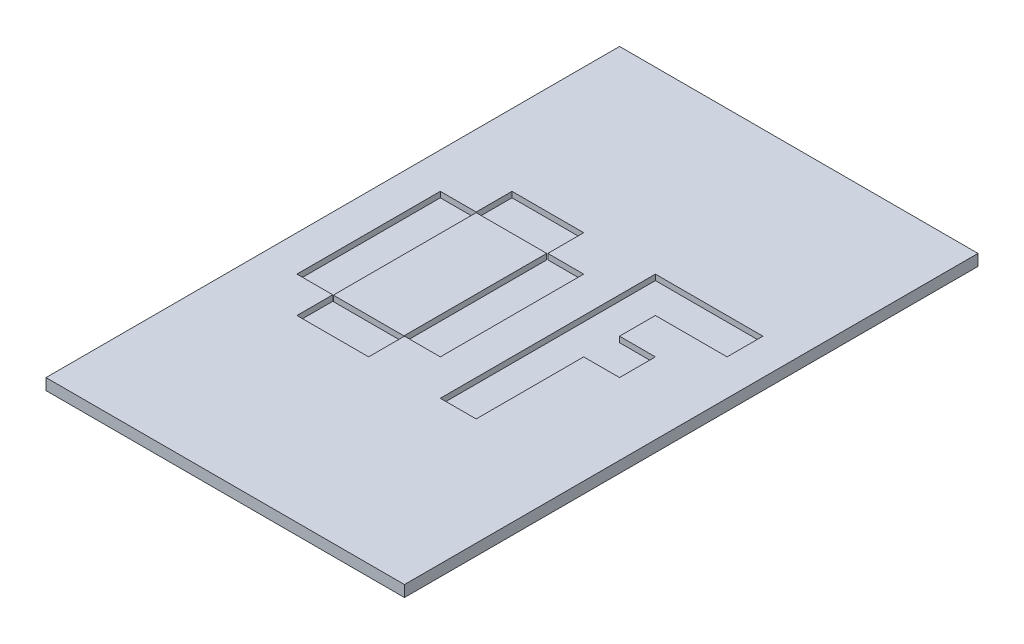
from build123d import *

# Parameters (mm, degrees)
SKETCH1_W            = 127
SKETCH1_H            = 203.2
BOSS_EXTRUDE1_DEPTH  = 4
CUT_EXTRUDE4_DEPTH   = 2
CUT_EXTRUDE8_DEPTH   = 2
SKETCH4_W            = 25
SKETCH4_H            = 50.6
BOSS_EXTRUDE10_DEPTH = 2


with BuildPart() as part:
    # Sketch1 → Boss-Extrude1 (new body)
    with BuildSketch(Plane(origin=(0, 0, 0), x_dir=(1, 0, 0), z_dir=(0, 1, 0))):
        with Locations((63.5, 101.6)):
            Rectangle(SKETCH1_W, SKETCH1_H)
    extrude(amount=BOSS_EXTRUDE1_DEPTH)

    # Sketch2 → Cut-Extrude4 (cut)
    with BuildSketch(Plane(origin=(0, 4, 0), x_dir=(1, 0, 0), z_dir=(0, 1, 0))):
        Polygon((88.9, 127), (88.9, 114.3), (101.6, 114.3), (101.6, 101.6), (88.9, 101.6), (88.9, 63.5), (76.2, 63.5), (76.2, 139.7), (88.9, 139.7), (114.3, 139.7), (114.3, 127), align=None)
    extrude(amount=-CUT_EXTRUDE4_DEPTH, mode=Mode.SUBTRACT)

    # Sketch2<5> → Cut-Extrude8 (cut)
    with BuildSketch(Plane(origin=(0, 4, 0), x_dir=(1, 0, 0), z_dir=(0, 1, 0))):
        Polygon((25.4, 127), (12.7, 127), (12.7, 76.2), (25.4, 76.2), (25.4, 63.5), (50.8, 63.5), (50.8, 76.2), (63.5, 76.2), (63.5, 127), (50.8, 127), (50.8, 139.7), (25.4, 139.7), align=None)
    extrude(amount=-CUT_EXTRUDE8_DEPTH, mode=Mode.SUBTRACT)


with BuildPart() as body_2:
    # Sketch4 → Boss-Extrude10 (new body)
    with BuildSketch(Plane(origin=(0, 2, 0), x_dir=(1, 0, 0), z_dir=(0, 1, 0))):
        with Locations((38.1, 101.5)):
            Rectangle(SKETCH4_W, SKETCH4_H)
    extrude(amount=BOSS_EXTRUDE10_DEPTH)


solid = Compound([part.part, body_2.part])
